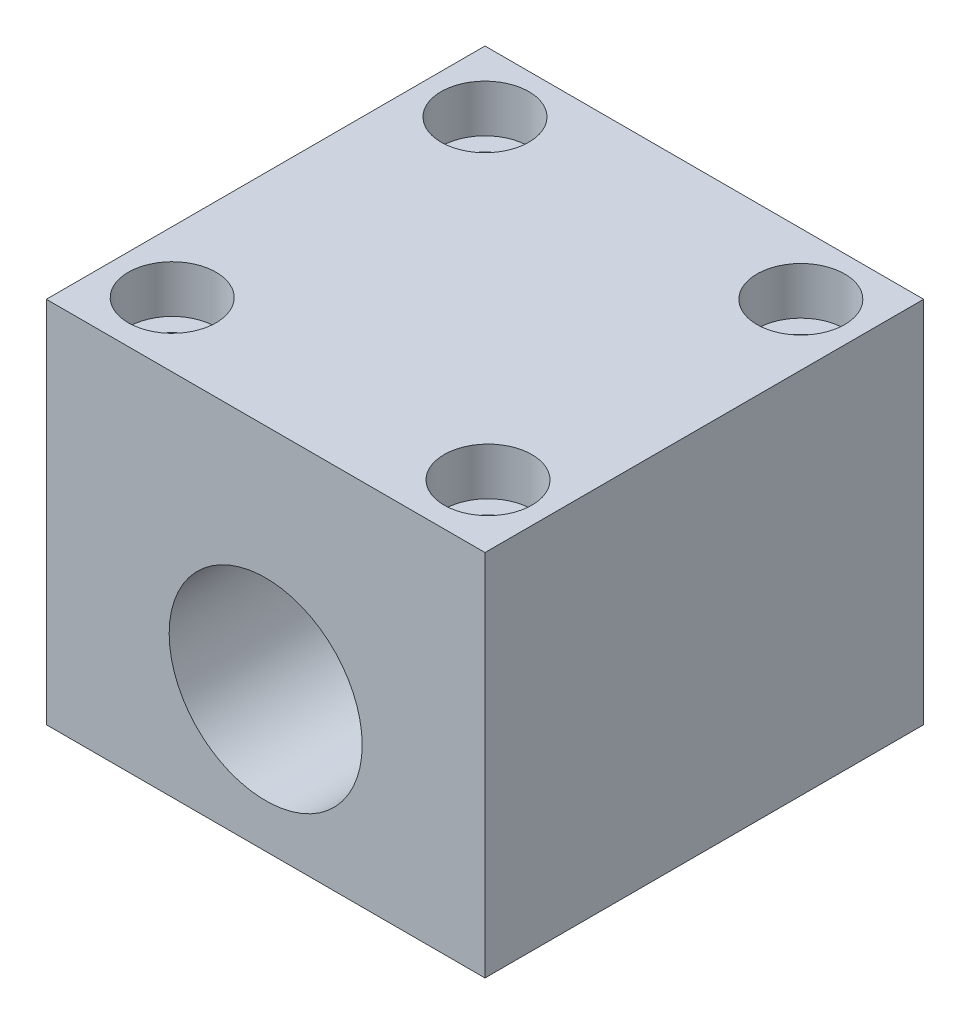
from build123d import *

# Parameters (mm, degrees)
EXTRUDE_608_DEPTH          = 50
SKETCH_2_R                 = 11
CUT_EXTRUDE_1_DEPTH        = 14
CUT_EXTRUDE_START          = -30
SKETCH_3_R                 = 11
CUT_EXTRUDE_2_DEPTH        = 30
SKETCH_4_R                 = 6.5
CUT_EXTRUDE_3_DEPTH        = 60.715994507
HOLE_WIZARD_M5_D           = 5.5
HOLE_WIZARD_M5_CBORE_D     = 10
HOLE_WIZARD_M5_CBORE_DEPTH = 5.4


with BuildPart() as part:
    # Эскиз1 → Extrude 608 (new body)
    with BuildSketch(Plane.XY):
        Polygon((-25, 21), (0, 21), (25, 21), (25, -21), (-25, -21), align=None)
    extrude(amount=-EXTRUDE_608_DEPTH)

    # Эскиз2 → Вырез-Вытянуть1 (cut)
    with BuildSketch(Plane(origin=(0, 0, -50), x_dir=(-1, 0, 0), z_dir=(0, 0, -1))):
        with Locations((0, -5)):
            Circle(SKETCH_2_R)
    extrude(amount=-CUT_EXTRUDE_1_DEPTH, mode=Mode.SUBTRACT)

    # Эскиз3 → Вырез-Вытянуть2 (cut)
    with BuildSketch(Plane.XY.offset(CUT_EXTRUDE_START)):
        with Locations(Location((0, -5, 0), (0, 0, 180))):
            Circle(SKETCH_3_R)
    extrude(amount=CUT_EXTRUDE_2_DEPTH, mode=Mode.SUBTRACT)

    # Эскиз4 → Вырез-Вытянуть3 (cut, through all)
    with BuildSketch(Plane.XY):
        with Locations((0, -5)):
            Circle(SKETCH_4_R)
    extrude(amount=-CUT_EXTRUDE_3_DEPTH, mode=Mode.SUBTRACT)

    # Крепление M5 (through all)
    with Locations(Plane(origin=(0, 21, 0), x_dir=(1, 0, 0), z_dir=(0, 1, 0))):
        with Locations((-18, 43), (-18, 7.344841497), (18, 7.344841497), (18, 43)):
            CounterBoreHole(HOLE_WIZARD_M5_D / 2, HOLE_WIZARD_M5_CBORE_D / 2, HOLE_WIZARD_M5_CBORE_DEPTH)


solid = part.part
